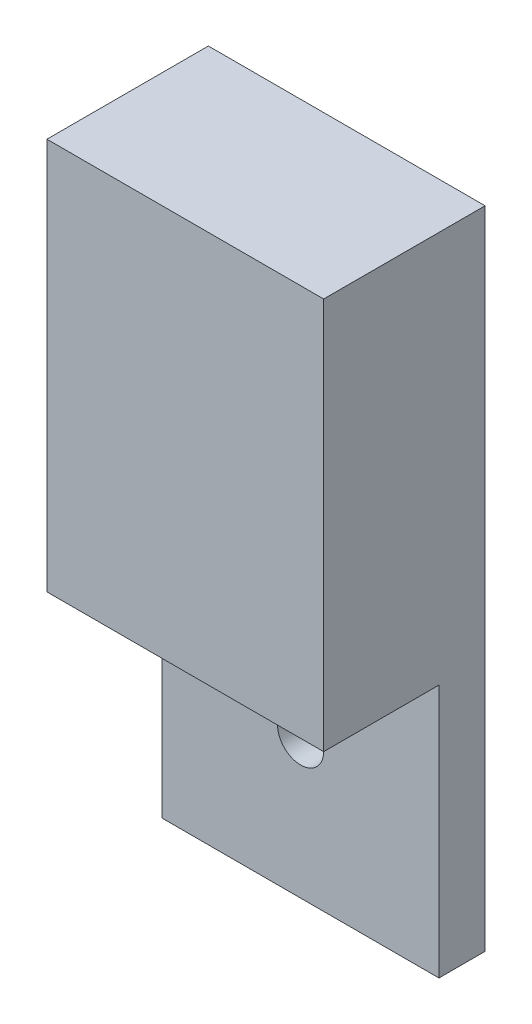
from build123d import *

# Parameters (mm, degrees)
SKETCH_1_W          = 12
SKETCH_1_H          = 28
EXTRUDE_1_DEPTH     = 2
SKETCH_2_W          = 12
SKETCH_2_H          = 17
EXTRUDE_2_DEPTH     = 5
CUT_EXTRUDE_1_REACH = 18.031
SKETCH_3_R          = 1


with BuildPart() as part:
    # 草图1 → 凸台-拉伸1 (new body)
    with BuildSketch(Plane.XY):
        Rectangle(SKETCH_1_W, SKETCH_1_H)
    extrude(amount=-EXTRUDE_1_DEPTH)

    # 草图2 → 凸台-拉伸2 (add)
    with BuildSketch(Plane.XY):
        with Locations((0, 5.5)):
            Rectangle(SKETCH_2_W, SKETCH_2_H)
    extrude(amount=EXTRUDE_2_DEPTH)

    # 草图3 → 切除-拉伸1 (cut, up to next)
    with BuildSketch(Plane.XY, mode=Mode.PRIVATE) as cut_extrude_1_sk1:
        with Locations((0, -8)):
            Circle(SKETCH_3_R)
    cut_extrude_1_tool1 = extrude(cut_extrude_1_sk1.sketch, amount=-CUT_EXTRUDE_1_REACH, mode=Mode.PRIVATE) & part.part
    add(cut_extrude_1_tool1.solids().sort_by_distance((0, -8, 0))[0], mode=Mode.SUBTRACT)


solid = part.part
